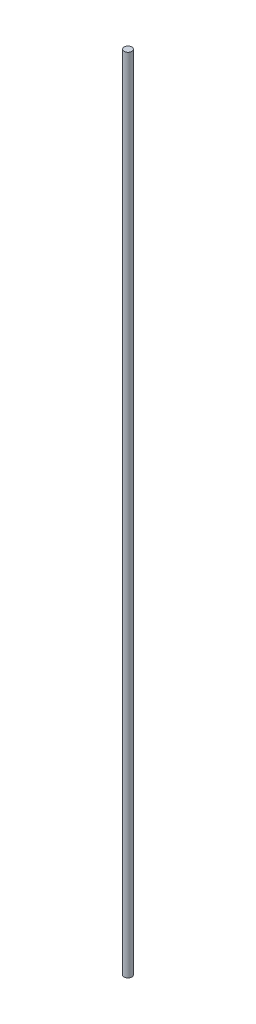
from build123d import *

# Parameters (mm, degrees)
SKIZZE1_R                       = 0.75
AUFSATZ_LINEAR_AUSTRAGEN1_DEPTH = 155


with BuildPart() as part:
    # Skizze1 → Aufsatz-Linear austragen1 (new body)
    with BuildSketch(Plane(origin=(0, 0, 0), x_dir=(1, 0, 0), z_dir=(0, 1, 0))):
        with Locations(Location((0, 0, 0), (0, 0, 270))):
            Circle(SKIZZE1_R)
    extrude(amount=AUFSATZ_LINEAR_AUSTRAGEN1_DEPTH)


solid = part.part
